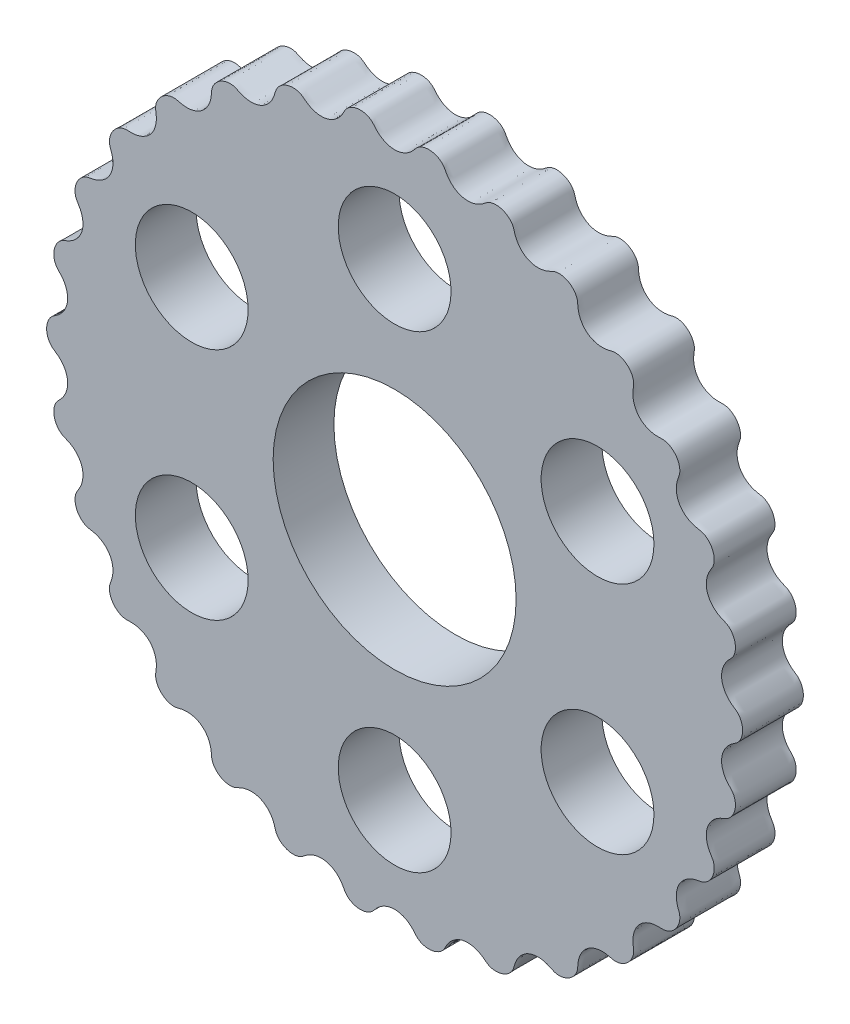
from build123d import *

# Parameters (mm, degrees)
BOSS_EXTRUDE1_DEPTH = 7
SKETCH2_R           = 14
SKETCH2_R_2         = 6.5
CUT_EXTRUDE1_DEPTH  = 7


with BuildPart() as part:
    # Sketch1 → Boss-Extrude1 (new body)
    with BuildSketch(Plane.XY):
        with BuildLine():
            add(Edge.make_bspline(
                [(0, 37.9), (-0.615891896, 37.9), (-1.474663277, 38.223493581), (-2.141625267, 38.885335751), (-2.384573692, 39.180069673), (-2.508247024, 39.322601964), (-2.615038469, 39.427604134), (-2.740598491, 39.529176141), (-2.900087625, 39.632262239), (-3.098789982, 39.730626324), (-3.335361886, 39.814266006), (-3.603505833, 39.873031303), (-3.893254636, 39.898780753), (-4.192270591, 39.886801391), (-4.487246422, 39.836355414), (-4.765304053, 39.750910245), (-5.015380929, 39.637698996), (-5.229388635, 39.506692206), (-5.403296521, 39.369163357), (-5.537861335, 39.235164723), (-5.639565233, 39.109711252), (-5.722193561, 38.984799965), (-5.813534325, 38.819671321), (-5.989884777, 38.480861983), (-6.504688288, 37.694828556), (-7.831607471, 36.844852922), (-9.389553704, 37.081609384), (-10.179530839, 37.590338158), (-10.478454709, 37.828106537), (-10.629058687, 37.941818131), (-10.75535464, 38.022316498), (-10.899291509, 38.095561236), (-11.076728387, 38.163233155), (-11.291537399, 38.218138621), (-11.540330384, 38.250772048), (-11.814833508, 38.252496664), (-12.103604806, 38.217451722), (-12.393592971, 38.143556726), (-12.671629488, 38.032883095), (-12.925855689, 37.89150709), (-13.146919108, 37.728760129), (-13.329023394, 37.556129828), (-13.47052492, 37.385437917), (-13.574302107, 37.226400469), (-13.647685193, 37.082533447), (-13.702545861, 36.943178101), (-13.75756535, 36.762666715), (-13.859618764, 36.394596506), (-14.199725694, 35.51869555), (-15.320958255, 34.411417425), (-16.89406219, 34.319117635), (-17.772566664, 34.652432552), (-18.11437797, 34.822884198), (-18.285335451, 34.902785377), (-18.425607891, 34.955268749), (-18.581627908, 34.996999768), (-18.76925988, 35.026300282), (-18.990789684, 35.035347115), (-19.240928967, 35.015529754), (-19.50979172, 34.960145445), (-19.784968468, 34.865827822), (-20.053254296, 34.733252634), (-20.302204535, 34.567192371), (-20.521472475, 34.376041309), (-20.703874694, 34.170899539), (-20.846111618, 33.964183738), (-20.949026039, 33.767799621), (-21.017475525, 33.590662482), (-21.059348151, 33.4346798), (-21.084031484, 33.286961925), (-21.100308529, 33.098955618), (-21.123620454, 32.717713242), (-21.27417259, 31.790239757), (-22.140692651, 30.474037751), (-23.660231217, 30.056688768), (-24.588836727, 30.200075784), (-24.958619767, 30.295730698), (-25.142456911, 30.338339097), (-25.290575355, 30.360516592), (-25.4518599, 30.368883083), (-25.641481217, 30.358541685), (-25.860050934, 30.321333806), (-26.1006041, 30.249943563), (-26.352072488, 30.1398588), (-26.601626818, 29.990392871), (-26.836496357, 29.804945039), (-27.045479459, 29.59075028), (-27.220214458, 29.358188904), (-27.355964729, 29.119599384), (-27.452127889, 28.887835119), (-27.51195899, 28.674345022), (-27.542086789, 28.486846288), (-27.550607035, 28.325569883), (-27.544041279, 28.175947053), (-27.520890353, 27.988662066), (-27.464397427, 27.610906196), (-27.418862926, 26.672394745), (-27.992774511, 25.204810873), (-29.392334461, 24.480618008), (-30.33046496, 24.427828341), (-30.712055739, 24.444513114), (-30.900731703, 24.447968925), (-31.050220447, 24.438855064), (-31.209720545, 24.413519876), (-31.393045699, 24.363972818), (-31.599104105, 24.282134829), (-31.819558633, 24.162287975), (-32.042654114, 24.002338506), (-32.255671826, 23.804244287), (-32.446841943, 23.574013849), (-32.606734855, 23.321054426), (-32.729293473, 23.057243738), (-32.812495895, 22.795646928), (-32.858336485, 22.548947217), (-32.87249782, 22.327681084), (-32.862966056, 22.138017106), (-32.837774877, 21.978493127), (-32.800249819, 21.833507175), (-32.738656642, 21.655131511), (-32.60486867, 21.297370351), (-32.365192815, 20.388837177), (-32.62143682, 18.834001274), (-33.83984591, 17.834643909), (-34.746501688, 17.587979593), (-35.123219242, 17.524930094), (-35.30849575, 17.489099273), (-35.452826422, 17.449106733), (-35.603570069, 17.391155342), (-35.772587613, 17.304574528), (-35.957126754, 17.181682078), (-36.147854019, 17.018632128), (-36.332805974, 16.815782206), (-36.49998255, 16.577730629), (-36.639114151, 16.312783965), (-36.742917904, 16.032111772), (-36.807953114, 15.748584894), (-36.834934182, 15.475405166), (-36.828496526, 15.224564575), (-36.796337259, 15.005191476), (-36.74758492, 14.821654759), (-36.689785835, 14.670847968), (-36.622925113, 14.536836035), (-36.525587016, 14.375167226), (-36.320358907, 14.05302934), (-35.896995197, 13.214196319), (-35.824397009, 11.640049825), (-36.808392416, 10.409207772), (-37.643957382, 9.979435232), (-37.999335793, 9.839445582), (-38.173108406, 9.765868517), (-38.305970475, 9.696746547), (-38.441372552, 9.608716767), (-38.588697302, 9.488888667), (-38.74365273, 9.330312931), (-38.896310513, 9.131171219), (-39.035046661, 8.894298831), (-39.149073992, 8.626691117), (-39.230086239, 8.338610139), (-39.273261227, 8.04248612), (-39.277925725, 7.75163377), (-39.247521615, 7.478815333), (-39.189065862, 7.234798514), (-39.112003884, 7.02690445), (-39.026154926, 6.857514223), (-38.938259211, 6.722023888), (-38.845006247, 6.604833283), (-38.716178857, 6.466940677), (-38.448457168, 6.194517936), (-37.859965333, 5.46202424), (-37.461643007, 3.93737912), (-38.168250783, 2.528869372), (-38.896175568, 1.934731584), (-39.214690696, 1.723928505), (-39.369368589, 1.61582626), (-39.48495494, 1.520593173), (-39.599105592, 1.40634403), (-39.718287633, 1.258493647), (-39.836888877, 1.071166515), (-39.944802011, 0.844633706), (-40.031264216, 0.584096525), (-40.087178729, 0.298629833), (-40.106501482, 0), (-40.087178729, -0.298629833), (-40.031264216, -0.584096525), (-39.944802011, -0.844633706), (-39.836888877, -1.071166515), (-39.718287633, -1.258493647), (-39.599105592, -1.40634403), (-39.48495494, -1.520593173), (-39.369368589, -1.61582626), (-39.214690696, -1.723928505), (-38.896175568, -1.934731584), (-38.168250783, -2.528869372), (-37.461643007, -3.93737912), (-37.859965333, -5.46202424), (-38.448457168, -6.194517936), (-38.716178857, -6.466940677), (-38.845006247, -6.604833283), (-38.938259211, -6.722023888), (-39.026154926, -6.857514223), (-39.112003884, -7.02690445), (-39.189065862, -7.234798514), (-39.247521615, -7.478815333), (-39.277925725, -7.75163377), (-39.273261227, -8.04248612), (-39.230086239, -8.338610139), (-39.149073992, -8.626691117), (-39.035046661, -8.894298831), (-38.896310513, -9.131171219), (-38.74365273, -9.330312931), (-38.588697302, -9.488888667), (-38.441372552, -9.608716767), (-38.305970475, -9.696746547), (-38.173108406, -9.765868517), (-37.999335793, -9.839445582), (-37.643957382, -9.979435232), (-36.808392416, -10.409207772), (-35.824397009, -11.640049825), (-35.896995197, -13.214196319), (-36.320358907, -14.05302934), (-36.525587016, -14.375167226), (-36.622925113, -14.536836035), (-36.689785835, -14.670847968), (-36.74758492, -14.821654759), (-36.796337259, -15.005191476), (-36.828496526, -15.224564575), (-36.834934182, -15.475405166), (-36.807953114, -15.748584894), (-36.742917904, -16.032111772), (-36.639114151, -16.312783965), (-36.49998255, -16.577730629), (-36.332805974, -16.815782206), (-36.147854019, -17.018632128), (-35.957126754, -17.181682078), (-35.772587613, -17.304574528), (-35.603570069, -17.391155342), (-35.452826422, -17.449106733), (-35.30849575, -17.489099273), (-35.123219242, -17.524930094), (-34.746501688, -17.587979593), (-33.83984591, -17.834643909), (-32.62143682, -18.834001274), (-32.365192815, -20.388837177), (-32.60486867, -21.297370351), (-32.738656642, -21.655131511), (-32.800249819, -21.833507175), (-32.837774877, -21.978493127), (-32.862966056, -22.138017106), (-32.87249782, -22.327681084), (-32.858336485, -22.548947217), (-32.812495895, -22.795646928), (-32.729293473, -23.057243738), (-32.606734855, -23.321054426), (-32.446841943, -23.574013849), (-32.255671826, -23.804244287), (-32.042654114, -24.002338506), (-31.819558633, -24.162287975), (-31.599104105, -24.282134829), (-31.393045699, -24.363972818), (-31.209720545, -24.413519876), (-31.050220447, -24.438855064), (-30.900731703, -24.447968925), (-30.712055739, -24.444513114), (-30.33046496, -24.427828341), (-29.392334461, -24.480618008), (-27.992774511, -25.204810873), (-27.418862926, -26.672394745), (-27.464397427, -27.610906196), (-27.520890353, -27.988662066), (-27.544041279, -28.175947053), (-27.550607035, -28.325569883), (-27.542086789, -28.486846288), (-27.51195899, -28.674345022), (-27.452127889, -28.887835119), (-27.355964729, -29.119599384), (-27.220214458, -29.358188904), (-27.045479459, -29.59075028), (-26.836496357, -29.804945039), (-26.601626818, -29.990392871), (-26.352072488, -30.1398588), (-26.1006041, -30.249943563), (-25.860050934, -30.321333806), (-25.641481217, -30.358541685), (-25.4518599, -30.368883083), (-25.290575355, -30.360516592), (-25.142456911, -30.338339097), (-24.958619767, -30.295730698), (-24.588836727, -30.200075784), (-23.660231217, -30.056688768), (-22.140692651, -30.474037751), (-21.27417259, -31.790239757), (-21.123620454, -32.717713242), (-21.100308529, -33.098955618), (-21.084031484, -33.286961925), (-21.059348151, -33.4346798), (-21.017475525, -33.590662482), (-20.949026039, -33.767799621), (-20.846111618, -33.964183738), (-20.703874694, -34.170899539), (-20.521472475, -34.376041309), (-20.302204535, -34.567192371), (-20.053254296, -34.733252634), (-19.784968468, -34.865827822), (-19.50979172, -34.960145445), (-19.240928967, -35.015529754), (-18.990789684, -35.035347115), (-18.76925988, -35.026300282), (-18.581627908, -34.996999768), (-18.425607891, -34.955268749), (-18.285335451, -34.902785377), (-18.11437797, -34.822884198), (-17.772566664, -34.652432552), (-16.89406219, -34.319117635), (-15.320958255, -34.411417425), (-14.199725694, -35.51869555), (-13.859618764, -36.394596506), (-13.75756535, -36.762666715), (-13.702545861, -36.943178101), (-13.647685193, -37.082533447), (-13.574302107, -37.226400469), (-13.47052492, -37.385437917), (-13.329023394, -37.556129828), (-13.146919108, -37.728760129), (-12.925855689, -37.89150709), (-12.671629488, -38.032883095), (-12.393592971, -38.143556726), (-12.103604806, -38.217451722), (-11.814833508, -38.252496664), (-11.540330384, -38.250772048), (-11.291537399, -38.218138621), (-11.076728387, -38.163233155), (-10.899291509, -38.095561236), (-10.75535464, -38.022316498), (-10.629058687, -37.941818131), (-10.478454709, -37.828106537), (-10.179530839, -37.590338158), (-9.389553704, -37.081609384), (-7.831607471, -36.844852922), (-6.504688288, -37.694828556), (-5.989884777, -38.480861983), (-5.813534325, -38.819671321), (-5.722193561, -38.984799965), (-5.639565233, -39.109711252), (-5.537861335, -39.235164723), (-5.403296521, -39.369163357), (-5.229388635, -39.506692206), (-5.015380929, -39.637698996), (-4.765304053, -39.750910245), (-4.487246422, -39.836355414), (-4.192270591, -39.886801391), (-3.893254636, -39.898780753), (-3.603505833, -39.873031303), (-3.335361886, -39.814266006), (-3.098789982, -39.730626324), (-2.900087625, -39.632262239), (-2.740598491, -39.529176141), (-2.615038469, -39.427604134), (-2.508247024, -39.322601964), (-2.384573692, -39.180069673), (-2.141625267, -38.885335751), (-1.474663277, -38.223493581), (0, -37.667997538), (1.474663277, -38.223493581), (2.141625267, -38.885335751), (2.384573692, -39.180069673), (2.508247024, -39.322601964), (2.615038469, -39.427604134), (2.740598491, -39.529176141), (2.900087625, -39.632262239), (3.098789982, -39.730626324), (3.335361886, -39.814266006), (3.603505833, -39.873031303), (3.893254636, -39.898780753), (4.192270591, -39.886801391), (4.487246422, -39.836355414), (4.765304053, -39.750910245), (5.015380929, -39.637698996), (5.229388635, -39.506692206), (5.403296521, -39.369163357), (5.537861335, -39.235164723), (5.639565233, -39.109711252), (5.722193561, -38.984799965), (5.813534325, -38.819671321), (5.989884777, -38.480861983), (6.504688288, -37.694828556), (7.831607471, -36.844852922), (9.389553704, -37.081609384), (10.179530839, -37.590338158), (10.478454709, -37.828106537), (10.629058687, -37.941818131), (10.75535464, -38.022316498), (10.899291509, -38.095561236), (11.076728387, -38.163233155), (11.291537399, -38.218138621), (11.540330384, -38.250772048), (11.814833508, -38.252496664), (12.103604806, -38.217451722), (12.393592971, -38.143556726), (12.671629488, -38.032883095), (12.925855689, -37.89150709), (13.146919108, -37.728760129), (13.329023394, -37.556129828), (13.47052492, -37.385437917), (13.574302107, -37.226400469), (13.647685193, -37.082533447), (13.702545861, -36.943178101), (13.75756535, -36.762666715), (13.859618764, -36.394596506), (14.199725694, -35.51869555), (15.320958255, -34.411417425), (16.89406219, -34.319117635), (17.772566664, -34.652432552), (18.11437797, -34.822884198), (18.285335451, -34.902785377), (18.425607891, -34.955268749), (18.581627908, -34.996999768), (18.76925988, -35.026300282), (18.990789684, -35.035347115), (19.240928967, -35.015529754), (19.50979172, -34.960145445), (19.784968468, -34.865827822), (20.053254296, -34.733252634), (20.302204535, -34.567192371), (20.521472475, -34.376041309), (20.703874694, -34.170899539), (20.846111618, -33.964183738), (20.949026039, -33.767799621), (21.017475525, -33.590662482), (21.059348151, -33.4346798), (21.084031484, -33.286961925), (21.100308529, -33.098955618), (21.123620454, -32.717713242), (21.27417259, -31.790239757), (22.140692651, -30.474037751), (23.660231217, -30.056688768), (24.588836727, -30.200075784), (24.958619767, -30.295730698), (25.142456911, -30.338339097), (25.290575355, -30.360516592), (25.4518599, -30.368883083), (25.641481217, -30.358541685), (25.860050934, -30.321333806), (26.1006041, -30.249943563), (26.352072488, -30.1398588), (26.601626818, -29.990392871), (26.836496357, -29.804945039), (27.045479459, -29.59075028), (27.220214458, -29.358188904), (27.355964729, -29.119599384), (27.452127889, -28.887835119), (27.51195899, -28.674345022), (27.542086789, -28.486846288), (27.550607035, -28.325569883), (27.544041279, -28.175947053), (27.520890353, -27.988662066), (27.464397427, -27.610906196), (27.418862926, -26.672394745), (27.992774511, -25.204810873), (29.392334461, -24.480618008), (30.33046496, -24.427828341), (30.712055739, -24.444513114), (30.900731703, -24.447968925), (31.050220447, -24.438855064), (31.209720545, -24.413519876), (31.393045699, -24.363972818), (31.599104105, -24.282134829), (31.819558633, -24.162287975), (32.042654114, -24.002338506), (32.255671826, -23.804244287), (32.446841943, -23.574013849), (32.606734855, -23.321054426), (32.729293473, -23.057243738), (32.812495895, -22.795646928), (32.858336485, -22.548947217), (32.87249782, -22.327681084), (32.862966056, -22.138017106), (32.837774877, -21.978493127), (32.800249819, -21.833507175), (32.738656642, -21.655131511), (32.60486867, -21.297370351), (32.365192815, -20.388837177), (32.62143682, -18.834001274), (33.83984591, -17.834643909), (34.746501688, -17.587979593), (35.123219242, -17.524930094), (35.30849575, -17.489099273), (35.452826422, -17.449106733), (35.603570069, -17.391155342), (35.772587613, -17.304574528), (35.957126754, -17.181682078), (36.147854019, -17.018632128), (36.332805974, -16.815782206), (36.49998255, -16.577730629), (36.639114151, -16.312783965), (36.742917904, -16.032111772), (36.807953114, -15.748584894), (36.834934182, -15.475405166), (36.828496526, -15.224564575), (36.796337259, -15.005191476), (36.74758492, -14.821654759), (36.689785835, -14.670847968), (36.622925113, -14.536836035), (36.525587016, -14.375167226), (36.320358907, -14.05302934), (35.896995197, -13.214196319), (35.824397009, -11.640049825), (36.808392416, -10.409207772), (37.643957382, -9.979435232), (37.999335793, -9.839445582), (38.173108406, -9.765868517), (38.305970475, -9.696746547), (38.441372552, -9.608716767), (38.588697302, -9.488888667), (38.74365273, -9.330312931), (38.896310513, -9.131171219), (39.035046661, -8.894298831), (39.149073992, -8.626691117), (39.230086239, -8.338610139), (39.273261227, -8.04248612), (39.277925725, -7.75163377), (39.247521615, -7.478815333), (39.189065862, -7.234798514), (39.112003884, -7.02690445), (39.026154926, -6.857514223), (38.938259211, -6.722023888), (38.845006247, -6.604833283), (38.716178857, -6.466940677), (38.448457168, -6.194517936), (37.859965333, -5.46202424), (37.461643007, -3.93737912), (38.168250783, -2.528869372), (38.896175568, -1.934731584), (39.214690696, -1.723928505), (39.369368589, -1.61582626), (39.48495494, -1.520593173), (39.599105592, -1.40634403), (39.718287633, -1.258493647), (39.836888877, -1.071166515), (39.944802011, -0.844633706), (40.031264216, -0.584096525), (40.087178729, -0.298629833), (40.106501482, 0), (40.087178729, 0.298629833), (40.031264216, 0.584096525), (39.944802011, 0.844633706), (39.836888877, 1.071166515), (39.718287633, 1.258493647), (39.599105592, 1.40634403), (39.48495494, 1.520593173), (39.369368589, 1.61582626), (39.214690696, 1.723928505), (38.896175568, 1.934731584), (38.168250783, 2.528869372), (37.461643007, 3.93737912), (37.859965333, 5.46202424), (38.448457168, 6.194517936), (38.716178857, 6.466940677), (38.845006247, 6.604833283), (38.938259211, 6.722023888), (39.026154926, 6.857514223), (39.112003884, 7.02690445), (39.189065862, 7.234798514), (39.247521615, 7.478815333), (39.277925725, 7.75163377), (39.273261227, 8.04248612), (39.230086239, 8.338610139), (39.149073992, 8.626691117), (39.035046661, 8.894298831), (38.896310513, 9.131171219), (38.74365273, 9.330312931), (38.588697302, 9.488888667), (38.441372552, 9.608716767), (38.305970475, 9.696746547), (38.173108406, 9.765868517), (37.999335793, 9.839445582), (37.643957382, 9.979435232), (36.808392416, 10.409207772), (35.824397009, 11.640049825), (35.896995197, 13.214196319), (36.320358907, 14.05302934), (36.525587016, 14.375167226), (36.622925113, 14.536836035), (36.689785835, 14.670847968), (36.74758492, 14.821654759), (36.796337259, 15.005191476), (36.828496526, 15.224564575), (36.834934182, 15.475405166), (36.807953114, 15.748584894), (36.742917904, 16.032111772), (36.639114151, 16.312783965), (36.49998255, 16.577730629), (36.332805974, 16.815782206), (36.147854019, 17.018632128), (35.957126754, 17.181682078), (35.772587613, 17.304574528), (35.603570069, 17.391155342), (35.452826422, 17.449106733), (35.30849575, 17.489099273), (35.123219242, 17.524930094), (34.746501688, 17.587979593), (33.83984591, 17.834643909), (32.62143682, 18.834001274), (32.365192815, 20.388837177), (32.60486867, 21.297370351), (32.738656642, 21.655131511), (32.800249819, 21.833507175), (32.837774877, 21.978493127), (32.862966056, 22.138017106), (32.87249782, 22.327681084), (32.858336485, 22.548947217), (32.812495895, 22.795646928), (32.729293473, 23.057243738), (32.606734855, 23.321054426), (32.446841943, 23.574013849), (32.255671826, 23.804244287), (32.042654114, 24.002338506), (31.819558633, 24.162287975), (31.599104105, 24.282134829), (31.393045699, 24.363972818), (31.209720545, 24.413519876), (31.050220447, 24.438855064), (30.900731703, 24.447968925), (30.712055739, 24.444513114), (30.33046496, 24.427828341), (29.392334461, 24.480618008), (27.992774511, 25.204810873), (27.418862926, 26.672394745), (27.464397427, 27.610906196), (27.520890353, 27.988662066), (27.544041279, 28.175947053), (27.550607035, 28.325569883), (27.542086789, 28.486846288), (27.51195899, 28.674345022), (27.452127889, 28.887835119), (27.355964729, 29.119599384), (27.220214458, 29.358188904), (27.045479459, 29.59075028), (26.836496357, 29.804945039), (26.601626818, 29.990392871), (26.352072488, 30.1398588), (26.1006041, 30.249943563), (25.860050934, 30.321333806), (25.641481217, 30.358541685), (25.4518599, 30.368883083), (25.290575355, 30.360516592), (25.142456911, 30.338339097), (24.958619767, 30.295730698), (24.588836727, 30.200075784), (23.660231217, 30.056688768), (22.140692651, 30.474037751), (21.27417259, 31.790239757), (21.123620454, 32.717713242), (21.100308529, 33.098955618), (21.084031484, 33.286961925), (21.059348151, 33.4346798), (21.017475525, 33.590662482), (20.949026039, 33.767799621), (20.846111618, 33.964183738), (20.703874694, 34.170899539), (20.521472475, 34.376041309), (20.302204535, 34.567192371), (20.053254296, 34.733252634), (19.784968468, 34.865827822), (19.50979172, 34.960145445), (19.240928967, 35.015529754), (18.990789684, 35.035347115), (18.76925988, 35.026300282), (18.581627908, 34.996999768), (18.425607891, 34.955268749), (18.285335451, 34.902785377), (18.11437797, 34.822884198), (17.772566664, 34.652432552), (16.89406219, 34.319117635), (15.320958255, 34.411417425), (14.199725694, 35.51869555), (13.859618764, 36.394596506), (13.75756535, 36.762666715), (13.702545861, 36.943178101), (13.647685193, 37.082533447), (13.574302107, 37.226400469), (13.47052492, 37.385437917), (13.329023394, 37.556129828), (13.146919108, 37.728760129), (12.925855689, 37.89150709), (12.671629488, 38.032883095), (12.393592971, 38.143556726), (12.103604806, 38.217451722), (11.814833508, 38.252496664), (11.540330384, 38.250772048), (11.291537399, 38.218138621), (11.076728387, 38.163233155), (10.899291509, 38.095561236), (10.75535464, 38.022316498), (10.629058687, 37.941818131), (10.478454709, 37.828106537), (10.179530839, 37.590338158), (9.389553704, 37.081609384), (7.831607471, 36.844852922), (6.504688288, 37.694828556), (5.989884777, 38.480861983), (5.813534325, 38.819671321), (5.722193561, 38.984799965), (5.639565233, 39.109711252), (5.537861335, 39.235164723), (5.403296521, 39.369163357), (5.229388635, 39.506692206), (5.015380929, 39.637698996), (4.765304053, 39.750910245), (4.487246422, 39.836355414), (4.192270591, 39.886801391), (3.893254636, 39.898780753), (3.603505833, 39.873031303), (3.335361886, 39.814266006), (3.098789982, 39.730626324), (2.900087625, 39.632262239), (2.740598491, 39.529176141), (2.615038469, 39.427604134), (2.508247024, 39.322601964), (2.384573692, 39.180069673), (2.141625267, 38.885335751), (1.474663277, 38.223493581), (0.615891896, 37.9), (0, 37.9)],
                knots=[0, 0, 0, 0, 0.006324788, 0.008818993, 0.009773078, 0.010308641, 0.010786604, 0.011333292, 0.011990377, 0.012763466, 0.0136407, 0.014601218, 0.015619281, 0.016666665, 0.017714057, 0.018732132, 0.019692631, 0.020569886, 0.02134297, 0.02200004, 0.022546746, 0.02302471, 0.023560267, 0.024514359, 0.027008549, 0.033333331, 0.039658133, 0.042152312, 0.043106404, 0.043641953, 0.044119957, 0.044666643, 0.045323704, 0.046096815, 0.046974041, 0.047934563, 0.048952639, 0.05, 0.051047386, 0.052065458, 0.053025977, 0.053903226, 0.054676316, 0.055333397, 0.055880062, 0.056358072, 0.056893606, 0.057847697, 0.060341905, 0.066666689, 0.072991479, 0.075485669, 0.076439734, 0.076975284, 0.077453281, 0.077999986, 0.07865707, 0.079430161, 0.080307378, 0.081267916, 0.082285984, 0.083333352, 0.084380739, 0.085398787, 0.086359315, 0.08723655, 0.088009628, 0.088666729, 0.089213397, 0.089691417, 0.090226944, 0.091181027, 0.093675234, 0.10000003, 0.106324823, 0.108818993, 0.109773077, 0.110308636, 0.110786633, 0.111333328, 0.111990389, 0.11276349, 0.113640711, 0.114601233, 0.115619319, 0.116666684, 0.117714071, 0.118732139, 0.11969264, 0.120569876, 0.121342968, 0.122000043, 0.122546739, 0.123024716, 0.123560272, 0.124514377, 0.127008551, 0.133333347, 0.139658147, 0.142152341, 0.143106424, 0.143641972, 0.144119948, 0.144666644, 0.145323709, 0.146096795, 0.14697404, 0.147934578, 0.148952631, 0.15000001, 0.151047384, 0.152065462, 0.153025968, 0.15390322, 0.154676297, 0.155333409, 0.155880071, 0.156358047, 0.156893598, 0.157847708, 0.160341903, 0.16666668, 0.17299147, 0.175485669, 0.176439747, 0.176975319, 0.177453296, 0.177999991, 0.178657051, 0.179430148, 0.180307384, 0.18126789, 0.182285976, 0.183333341, 0.184380731, 0.185398772, 0.186359299, 0.187236565, 0.188009616, 0.188666725, 0.189213404, 0.189691391, 0.190226927, 0.191181041, 0.193675237, 0.200000027, 0.206324814, 0.208819006, 0.209773107, 0.210308656, 0.210786614, 0.211333332, 0.211990417, 0.212763473, 0.213640729, 0.214601249, 0.215619317, 0.216666681, 0.217714077, 0.218732135, 0.219692639, 0.220569892, 0.221342956, 0.22200006, 0.222546741, 0.223024731, 0.22356027, 0.224514357, 0.227008546, 0.233333334, 0.239658114, 0.242152293, 0.243106419, 0.243641936, 0.244119924, 0.244666626, 0.245323703, 0.246096798, 0.246974034, 0.247934544, 0.248952637, 0.25, 0.251047363, 0.252065456, 0.253025966, 0.253903202, 0.254676297, 0.255333374, 0.255880076, 0.256358064, 0.256893581, 0.257847707, 0.260341886, 0.266666666, 0.272991454, 0.275485643, 0.27643973, 0.276975269, 0.277453259, 0.27799994, 0.278657044, 0.279430108, 0.280307361, 0.281267865, 0.282285923, 0.283333319, 0.284380683, 0.285398751, 0.286359271, 0.287236527, 0.288009583, 0.288666668, 0.289213386, 0.289691344, 0.290226893, 0.291180994, 0.293675186, 0.299999973, 0.306324763, 0.308818959, 0.309773073, 0.310308609, 0.310786596, 0.311333275, 0.311990384, 0.312763435, 0.313640701, 0.314601228, 0.315619269, 0.316666659, 0.317714024, 0.31873211, 0.319692616, 0.320569852, 0.321342949, 0.322000009, 0.322546704, 0.323024681, 0.323560253, 0.324514331, 0.32700853, 0.33333332, 0.339658097, 0.342152292, 0.343106402, 0.343641953, 0.344119929, 0.344666591, 0.345323703, 0.34609678, 0.346974032, 0.347934538, 0.348952616, 0.34999999, 0.351047369, 0.352065422, 0.35302596, 0.353903205, 0.354676291, 0.355333356, 0.355880052, 0.356358028, 0.356893576, 0.357847659, 0.360341853, 0.366666653, 0.372991449, 0.375485623, 0.376439728, 0.376975284, 0.377453261, 0.377999957, 0.378657032, 0.379430124, 0.38030736, 0.381267861, 0.382285929, 0.383333316, 0.384380681, 0.385398767, 0.386359289, 0.38723651, 0.388009611, 0.388666672, 0.389213367, 0.389691364, 0.390226923, 0.391181007, 0.393675177, 0.39999997, 0.406324766, 0.408818973, 0.409773056, 0.410308583, 0.410786603, 0.411333271, 0.411990372, 0.41276345, 0.413640685, 0.414601213, 0.415619261, 0.416666648, 0.417714016, 0.418732084, 0.419692622, 0.420569839, 0.42134293, 0.422000014, 0.422546719, 0.423024716, 0.423560266, 0.424514331, 0.427008521, 0.433333311, 0.439658095, 0.442152303, 0.443106394, 0.443641928, 0.444119938, 0.444666603, 0.445323684, 0.446096774, 0.446974023, 0.447934542, 0.448952614, 0.45, 0.451047361, 0.452065437, 0.453025959, 0.453903185, 0.454676296, 0.455333357, 0.455880043, 0.456358047, 0.456893596, 0.457847688, 0.460341867, 0.466666669, 0.472991451, 0.475485641, 0.476439733, 0.47697529, 0.477453254, 0.47799996, 0.47865703, 0.479430114, 0.480307369, 0.481267868, 0.482285943, 0.483333335, 0.484380719, 0.485398782, 0.4863593, 0.487236534, 0.488009623, 0.488666708, 0.489213396, 0.489691359, 0.490226922, 0.491181007, 0.493675212, 0.5, 0.506324788, 0.508818993, 0.509773078, 0.510308641, 0.510786604, 0.511333292, 0.511990377, 0.512763466, 0.5136407, 0.514601218, 0.515619281, 0.516666665, 0.517714057, 0.518732132, 0.519692631, 0.520569886, 0.52134297, 0.52200004, 0.522546746, 0.52302471, 0.523560267, 0.524514359, 0.527008549, 0.533333331, 0.539658133, 0.542152312, 0.543106404, 0.543641953, 0.544119957, 0.544666643, 0.545323704, 0.546096815, 0.546974041, 0.547934563, 0.548952639, 0.55, 0.551047386, 0.552065458, 0.553025977, 0.553903226, 0.554676316, 0.555333397, 0.555880062, 0.556358072, 0.556893606, 0.557847697, 0.560341905, 0.566666689, 0.572991479, 0.575485669, 0.576439734, 0.576975284, 0.577453281, 0.577999986, 0.57865707, 0.579430161, 0.580307378, 0.581267916, 0.582285984, 0.583333352, 0.584380739, 0.585398787, 0.586359315, 0.58723655, 0.588009628, 0.588666729, 0.589213397, 0.589691417, 0.590226944, 0.591181027, 0.593675234, 0.60000003, 0.606324823, 0.608818993, 0.609773077, 0.610308636, 0.610786633, 0.611333328, 0.611990389, 0.61276349, 0.613640711, 0.614601233, 0.615619319, 0.616666684, 0.617714071, 0.618732139, 0.61969264, 0.620569876, 0.621342968, 0.622000043, 0.622546739, 0.623024716, 0.623560272, 0.624514377, 0.627008551, 0.633333347, 0.639658147, 0.642152341, 0.643106424, 0.643641972, 0.644119948, 0.644666644, 0.645323709, 0.646096795, 0.64697404, 0.647934578, 0.648952631, 0.65000001, 0.651047384, 0.652065462, 0.653025968, 0.65390322, 0.654676297, 0.655333409, 0.655880071, 0.656358047, 0.656893598, 0.657847708, 0.660341903, 0.66666668, 0.67299147, 0.675485669, 0.676439747, 0.676975319, 0.677453296, 0.677999991, 0.678657051, 0.679430148, 0.680307384, 0.68126789, 0.682285976, 0.683333341, 0.684380731, 0.685398772, 0.686359299, 0.687236565, 0.688009616, 0.688666725, 0.689213404, 0.689691391, 0.690226927, 0.691181041, 0.693675237, 0.700000027, 0.706324814, 0.708819006, 0.709773107, 0.710308656, 0.710786614, 0.711333332, 0.711990417, 0.712763473, 0.713640729, 0.714601249, 0.715619317, 0.716666681, 0.717714077, 0.718732135, 0.719692639, 0.720569892, 0.721342956, 0.72200006, 0.722546741, 0.723024731, 0.72356027, 0.724514357, 0.727008546, 0.733333334, 0.739658114, 0.742152293, 0.743106419, 0.743641936, 0.744119924, 0.744666626, 0.745323703, 0.746096798, 0.746974034, 0.747934544, 0.748952637, 0.75, 0.751047363, 0.752065456, 0.753025966, 0.753903202, 0.754676297, 0.755333374, 0.755880076, 0.756358064, 0.756893581, 0.757847707, 0.760341886, 0.766666666, 0.772991454, 0.775485643, 0.77643973, 0.776975269, 0.777453259, 0.77799994, 0.778657044, 0.779430108, 0.780307361, 0.781267865, 0.782285923, 0.783333319, 0.784380683, 0.785398751, 0.786359271, 0.787236527, 0.788009583, 0.788666668, 0.789213386, 0.789691344, 0.790226893, 0.791180994, 0.793675186, 0.799999973, 0.806324763, 0.808818959, 0.809773073, 0.810308609, 0.810786596, 0.811333275, 0.811990384, 0.812763435, 0.813640701, 0.814601228, 0.815619269, 0.816666659, 0.817714024, 0.81873211, 0.819692616, 0.820569852, 0.821342949, 0.822000009, 0.822546704, 0.823024681, 0.823560253, 0.824514331, 0.82700853, 0.83333332, 0.839658097, 0.842152292, 0.843106402, 0.843641953, 0.844119929, 0.844666591, 0.845323703, 0.84609678, 0.846974032, 0.847934538, 0.848952616, 0.84999999, 0.851047369, 0.852065422, 0.85302596, 0.853903205, 0.854676291, 0.855333356, 0.855880052, 0.856358028, 0.856893576, 0.857847659, 0.860341853, 0.866666653, 0.872991449, 0.875485623, 0.876439728, 0.876975284, 0.877453261, 0.877999957, 0.878657032, 0.879430124, 0.88030736, 0.881267861, 0.882285929, 0.883333316, 0.884380681, 0.885398767, 0.886359289, 0.88723651, 0.888009611, 0.888666672, 0.889213367, 0.889691364, 0.890226923, 0.891181007, 0.893675177, 0.89999997, 0.906324766, 0.908818973, 0.909773056, 0.910308583, 0.910786603, 0.911333271, 0.911990372, 0.91276345, 0.913640685, 0.914601213, 0.915619261, 0.916666648, 0.917714016, 0.918732084, 0.919692622, 0.920569839, 0.92134293, 0.922000014, 0.922546719, 0.923024716, 0.923560266, 0.924514331, 0.927008521, 0.933333311, 0.939658095, 0.942152303, 0.943106394, 0.943641928, 0.944119938, 0.944666603, 0.945323684, 0.946096774, 0.946974023, 0.947934542, 0.948952614, 0.95, 0.951047361, 0.952065437, 0.953025959, 0.953903185, 0.954676296, 0.955333357, 0.955880043, 0.956358047, 0.956893596, 0.957847688, 0.960341867, 0.966666669, 0.972991451, 0.975485641, 0.976439733, 0.97697529, 0.977453254, 0.97799996, 0.97865703, 0.979430114, 0.980307369, 0.981267868, 0.982285943, 0.983333335, 0.984380719, 0.985398782, 0.9863593, 0.987236534, 0.988009623, 0.988666708, 0.989213396, 0.989691359, 0.990226922, 0.991181007, 0.993675212, 1, 1, 1, 1], degree=3))
        make_face()
    extrude(amount=BOSS_EXTRUDE1_DEPTH)

    # Sketch2 → Cut-Extrude1 (cut)
    with BuildSketch(Plane.XY.offset(7)):
        Circle(SKETCH2_R)
        with Locations((0, 27)):
            Circle(SKETCH2_R_2)
        with Locations((23.382685902, 13.5)):
            Circle(SKETCH2_R_2)
        with Locations((23.382685902, -13.5)):
            Circle(SKETCH2_R_2)
        with Locations((0, -27)):
            Circle(SKETCH2_R_2)
        with Locations((-23.382685902, -13.5)):
            Circle(SKETCH2_R_2)
        with Locations((-23.382685902, 13.5)):
            Circle(SKETCH2_R_2)
    extrude(amount=-CUT_EXTRUDE1_DEPTH, mode=Mode.SUBTRACT)


solid = part.part
